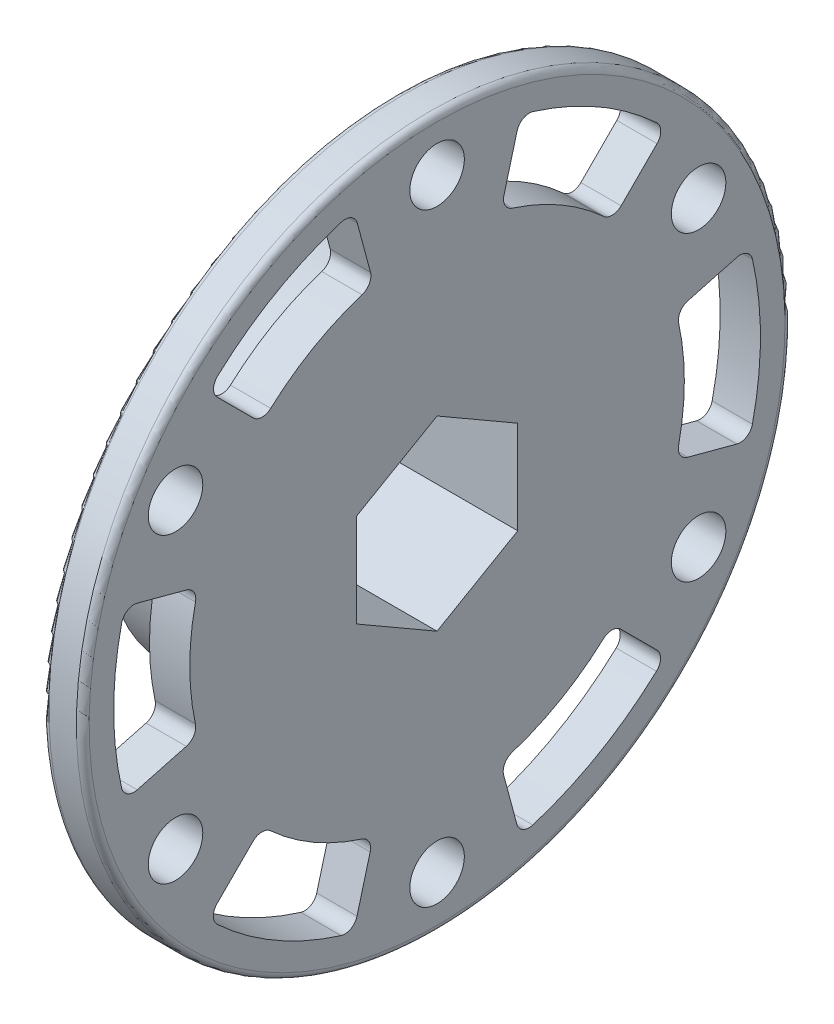
from build123d import *

# Parameters (mm, degrees)
SKETCH1_R           = 27.94
BOSS_EXTRUDE1_DEPTH = 3.175
CUT_EXTRUDE1_DEPTH  = 40.640482149
CIRPATTERN1_COUNT   = 6
SKETCH3_R           = 2.15
CUT_EXTRUDE2_DEPTH  = 40.640482149
CIRPATTERN2_COUNT   = 6
SKETCH4_R           = 14.294919975
BOSS_EXTRUDE2_DEPTH = 9.525
CUT_EXTRUDE3_DEPTH  = 42.503941981
CHAMFER1_SIZE       = 1
FILLET1_R           = 0.5
FILLET2_R           = 1
FILLET3_R           = 1.27


with BuildPart() as part:
    # Sketch1 → Boss-Extrude1 (new body)
    with BuildSketch(Plane(origin=(9.525, 0, 0), x_dir=(0, -1, 0), z_dir=(-1, 0, 0))):
        Circle(SKETCH1_R)
    extrude(amount=-BOSS_EXTRUDE1_DEPTH)

    # Sketch2 → Cut-Extrude1 (cut, through all)
    with BuildSketch(Plane.ZY.offset(-9.525)):
        with BuildLine():
            Line((-24.617911686, -6.648941586), (-18.822341689, -5.096023285))
            ThreePointArc((-18.822341689, -5.096023285), (-19.499995864, -0.012700024), (-18.82896363, 5.071501614))
            Line((-18.82896363, 5.071501614), (-24.624522347, 6.624416892))
            ThreePointArc((-24.624522347, 6.624416892), (-25.499996837, -0.012700014), (-24.617911686, -6.648941586))
        make_face()
    cut_extrude1 = extrude(amount=-CUT_EXTRUDE1_DEPTH, mode=Mode.SUBTRACT)

    # CirPattern1: Cut-Extrude1 ×6 about axis
    cirpattern1_axis = Axis((111.1125, 0, 0), (-1, 0, 0))
    for i in range(1, CIRPATTERN1_COUNT):
        add(cut_extrude1.rotate(cirpattern1_axis, i * 360 / CIRPATTERN1_COUNT), mode=Mode.SUBTRACT)

    # Sketch3 → Cut-Extrude2 (cut, through all)
    with BuildSketch(Plane.ZY.offset(-9.525)):
        with Locations((-20.622229928, 11.90625)):
            Circle(SKETCH3_R)
    cut_extrude2 = extrude(amount=-CUT_EXTRUDE2_DEPTH, mode=Mode.SUBTRACT)

    # CirPattern2: Cut-Extrude2 ×6 about axis
    cirpattern2_axis = Axis((111.1125, 0, 0), (-1, 0, 0))
    for i in range(1, CIRPATTERN2_COUNT):
        add(cut_extrude2.rotate(cirpattern2_axis, i * 360 / CIRPATTERN2_COUNT), mode=Mode.SUBTRACT)

    # Sketch4 → Boss-Extrude2 (add)
    with BuildSketch(Plane.ZY.offset(-9.525)):
        Circle(SKETCH4_R)
    extrude(amount=BOSS_EXTRUDE2_DEPTH)

    # Sketch5 → Cut-Extrude3 (cut, through all)
    with BuildSketch(Plane.ZY):
        Polygon((-6.3627, -3.673506558), (0, -7.347013116), (6.3627, -3.673506558), (6.3627, 3.673506558), (0, 7.347013116), (-6.3627, 3.673506558), align=None)
    extrude(amount=-CUT_EXTRUDE3_DEPTH, mode=Mode.SUBTRACT)

    # Chamfer1
    chamfer1_edges = [part.edges().sort_by_distance(p)[0] for p in [
        (0, 0, -14.294919975),
    ]]
    chamfer(chamfer1_edges, length=CHAMFER1_SIZE)

    # Fillet1
    fillet1_edges = [part.edges().sort_by_distance(p)[0] for p in [
        (12.7, 27.94, 0),
        (9.525, 27.94, 0),
    ]]
    fillet(fillet1_edges, radius=FILLET1_R)

    # Fillet2
    fillet2_edges = [part.edges().sort_by_distance(p)[0] for p in [
        (11.1125, 18.842111637, -5.022432582),
        (11.1125, -6.624416892, 24.624522347),
        (11.1125, 18.848637704, 4.997885221),
        (11.1125, -5.071501614, 18.82896363),
        (11.1125, 24.644207701, 6.550803522),
        (11.1125, -5.096023285, -18.822341689),
        (11.1125, 24.637670355, -6.57534786),
        (11.1125, 17.995266116, -18.067108165),
        (11.1125, 6.624416892, -24.624522347),
        (11.1125, -24.637670355, 6.57534786),
        (11.1125, 6.648941586, 24.617911686),
        (11.1125, 5.096023285, 18.822341689),
        (11.1125, -13.752614419, 13.824456468),
        (11.1125, 5.071501614, -18.82896363),
        (11.1125, -13.770610024, -13.806531048),
        (11.1125, -6.648941586, -24.617911686),
        (11.1125, -18.848637704, -4.997885221),
        (11.1125, 13.752614419, -13.824456468),
        (11.1125, -24.644207701, -6.550803522),
        (11.1125, 13.770610024, 13.806531048),
        (11.1125, -18.013253463, -18.049174487),
        (11.1125, 18.013253463, 18.049174487),
        (11.1125, -17.995266116, 18.067108165),
        (11.1125, -18.842111637, 5.022432582),
    ]]
    fillet(fillet2_edges, radius=FILLET2_R)

    # Fillet3
    fillet3_edges = [part.edges().sort_by_distance(p)[0] for p in [
        (9.525, 0, -14.294919975),
    ]]
    fillet(fillet3_edges, radius=FILLET3_R)


solid = part.part
